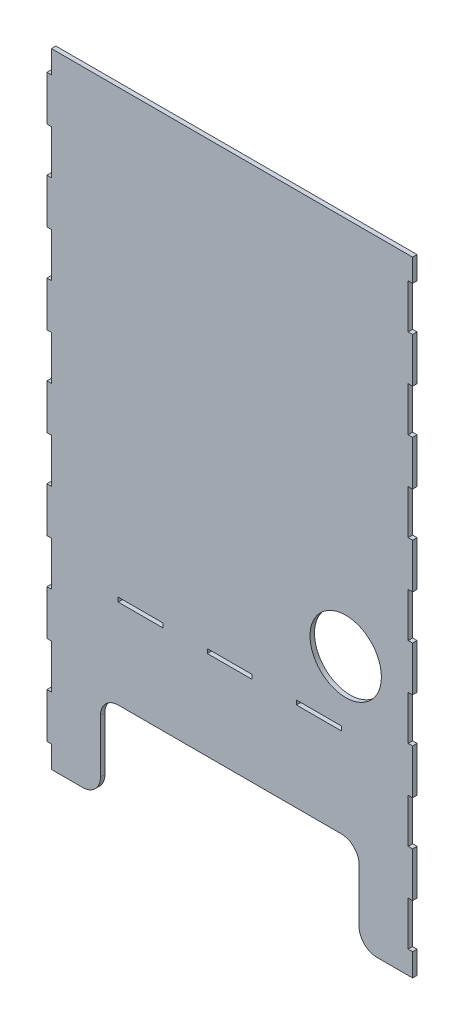
from build123d import *

# Parameters (mm, degrees)
AUFSATZ_LINEAR_AUSTRAGEN1_DEPTH = 5
SKIZZE2_W                       = 50.3
SKIZZE2_H                       = 4.8
SCHNITT_LINEAR_AUSTRAGEN1_DEPTH = 5
LINEARES_MUSTER1_COUNT          = 3
LINEARES_MUSTER1_PITCH          = 99.9
SKIZZE3_W                       = 92.912444059
SKIZZE3_H                       = 49.6
SCHNITT_LINEAR_AUSTRAGEN2_DEPTH = 5
LINEARES_MUSTER2_COUNT          = 8
LINEARES_MUSTER2_PITCH          = 99.9
SKIZZE4_W                       = 86.468004991
SKIZZE4_H                       = 49.6
SCHNITT_LINEAR_AUSTRAGEN4_DEPTH = 5
LINEARES_MUSTER3_COUNT          = 7
LINEARES_MUSTER3_PITCH          = 99.9
SKIZZE8_R                       = 40
SCHNITT_LINEAR_AUSTRAGEN5_DEPTH = 10


with BuildPart() as part:
    # Skizze1 → Aufsatz-Linear austragen1 (new body)
    with BuildSketch(Plane.XY):
        with BuildLine():
            Line((0, 0), (0, 700))
            Line((0, 700), (410, 700))
            Line((410, 700), (410, 0))
            Line((410, 0), (370, 0))
            ThreePointArc((370, 0), (355.857864376, 5.857864376), (350, 20))
            Line((350, 20), (350, 80))
            ThreePointArc((350, 80), (344.142135624, 94.142135624), (330, 100))
            Line((330, 100), (80, 100))
            ThreePointArc((80, 100), (65.857864376, 94.142135624), (60, 80))
            Line((60, 80), (60, 20))
            ThreePointArc((60, 20), (54.142135624, 5.857864376), (40, 0))
            Line((40, 0), (0, 0))
        make_face()
    extrude(amount=AUFSATZ_LINEAR_AUSTRAGEN1_DEPTH)

    # Skizze2 → Schnitt-Linear austragen1 (cut)
    with BuildSketch(Plane.XY.offset(5)):
        with Locations((105.1, 202.4)):
            Rectangle(SKIZZE2_W, SKIZZE2_H)
    schnitt_linear_austragen1 = extrude(amount=-SCHNITT_LINEAR_AUSTRAGEN1_DEPTH, mode=Mode.SUBTRACT)

    # Lineares Muster1: Schnitt-Linear austragen1 ×3
    with Locations(*[(i * LINEARES_MUSTER1_PITCH, 0, 0) for i in range(1, LINEARES_MUSTER1_COUNT)]):
        add(schnitt_linear_austragen1, mode=Mode.SUBTRACT)

    # Skizze3 → Schnitt-Linear austragen2 (cut)
    with BuildSketch(Plane.XY.offset(5)):
        with Locations((-41.45622203, 699.3)):
            Rectangle(SKIZZE3_W, SKIZZE3_H)
    schnitt_linear_austragen2 = extrude(amount=-SCHNITT_LINEAR_AUSTRAGEN2_DEPTH, mode=Mode.SUBTRACT)

    # Lineares Muster2: Schnitt-Linear austragen2 ×8
    with Locations(*[(0, -i * LINEARES_MUSTER2_PITCH, 0) for i in range(1, LINEARES_MUSTER2_COUNT)]):
        add(schnitt_linear_austragen2, mode=Mode.SUBTRACT)

    # Skizze4 → Schnitt-Linear austragen4 (cut)
    with BuildSketch(Plane.XY.offset(5)):
        with Locations((448.234002496, 649.7)):
            Rectangle(SKIZZE4_W, SKIZZE4_H)
    schnitt_linear_austragen4 = extrude(amount=-SCHNITT_LINEAR_AUSTRAGEN4_DEPTH, mode=Mode.SUBTRACT)

    # Lineares Muster3: Schnitt-Linear austragen4 ×7
    with Locations(*[(0, -i * LINEARES_MUSTER3_PITCH, 0) for i in range(1, LINEARES_MUSTER3_COUNT)]):
        add(schnitt_linear_austragen4, mode=Mode.SUBTRACT)

    # Skizze8 → Schnitt-Linear austragen5 (cut)
    with BuildSketch(Plane.XY.offset(5)):
        with Locations((335, 274.8)):
            Circle(SKIZZE8_R)
    extrude(amount=-SCHNITT_LINEAR_AUSTRAGEN5_DEPTH, mode=Mode.SUBTRACT)


solid = part.part
